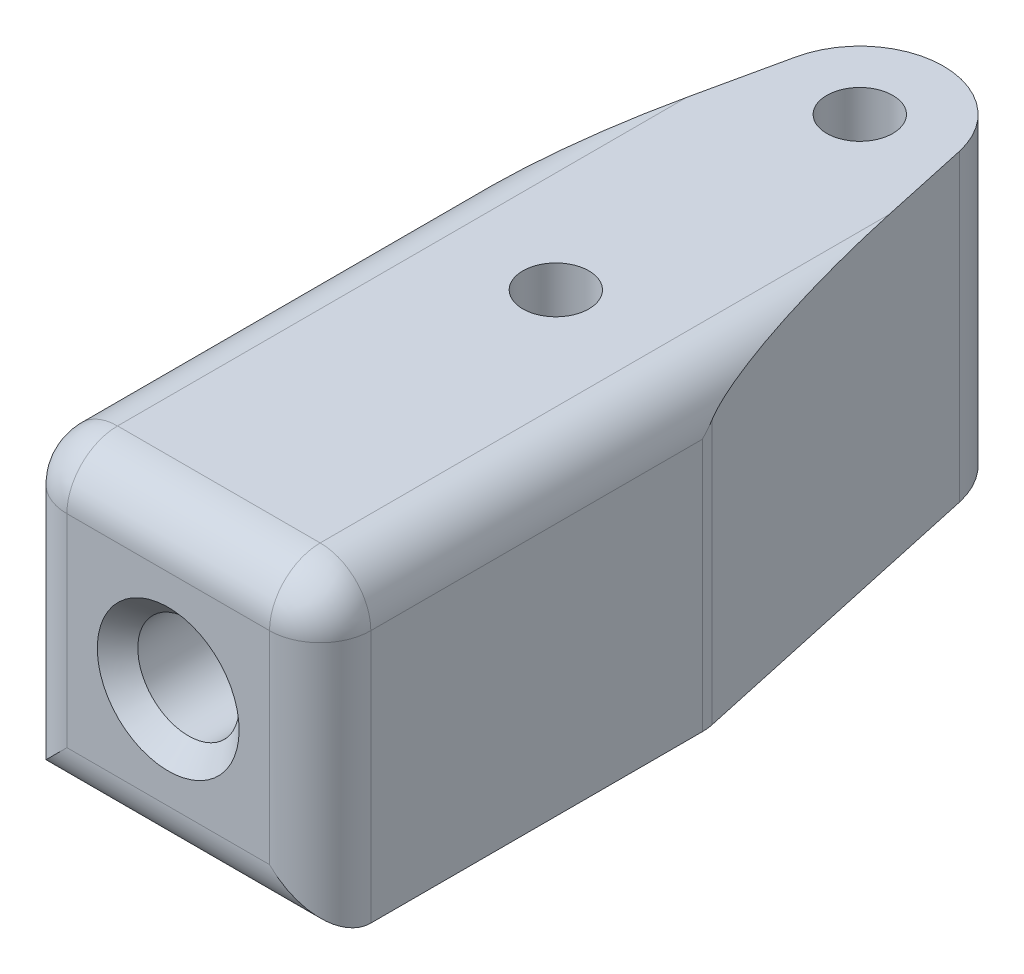
from build123d import *

# Parameters (mm, degrees)
SKETCH2_R           = 2.0701
BOSS_EXTRUDE1_DEPTH = 19.05
SKETCH3_R           = 3.175
CUT_EXTRUDE1_DEPTH  = 19.05
CHAMFER1_SIZE       = 1.27
FILLET1_R           = 3.175


with BuildPart() as part:
    # Sketch2 → Boss-Extrude1 (new body)
    with BuildSketch(Plane(origin=(0, 0, 0), x_dir=(1, 0, 0), z_dir=(0, 1, 0))):
        with BuildLine():
            Line((9.525, -24.2951), (-9.525, -24.2951))
            Line((-9.525, -24.2951), (-9.525, 0))
            Line((-9.525, 0), (-5.12453766, 20.168117963))
            ThreePointArc((-5.12453766, 20.168117963), (0, 24.2951), (5.12453766, 20.168117963))
            Line((5.12453766, 20.168117963), (9.525, 0))
            Line((9.525, 0), (9.525, -24.2951))
        make_face()
        with Locations(Location((0, 0, 0), (0, 0, 90))):
            Circle(SKETCH2_R, mode=Mode.SUBTRACT)
        with Locations(Location((0, 19.05, 0), (0, 0, 90))):
            Circle(SKETCH2_R, mode=Mode.SUBTRACT)
    extrude(amount=BOSS_EXTRUDE1_DEPTH)

    # Sketch3 → Cut-Extrude1 (cut)
    with BuildSketch(Plane.XY.offset(24.2951)):
        with Locations((0, 9.525)):
            Circle(SKETCH3_R)
    extrude(amount=-CUT_EXTRUDE1_DEPTH, mode=Mode.SUBTRACT)

    # Chamfer1
    chamfer1_edges = [part.edges().sort_by_distance(p)[0] for p in [
        (-3.175, 9.525, 24.2951),
    ]]
    chamfer(chamfer1_edges, length=CHAMFER1_SIZE)

    # Fillet1
    fillet1_edges = [part.edges().sort_by_distance(p)[0] for p in [
        (9.525, 9.525, 0),
        (9.525, 9.525, 24.2951),
        (-9.525, 9.525, 24.2951),
        (-9.525, 9.525, 0),
        (-9.525, 19.05, 12.14755),
        (0, 19.05, 24.2951),
        (9.525, 19.05, 12.14755),
        (0, 0, 24.2951),
    ]]
    fillet(fillet1_edges, radius=FILLET1_R)


solid = part.part
